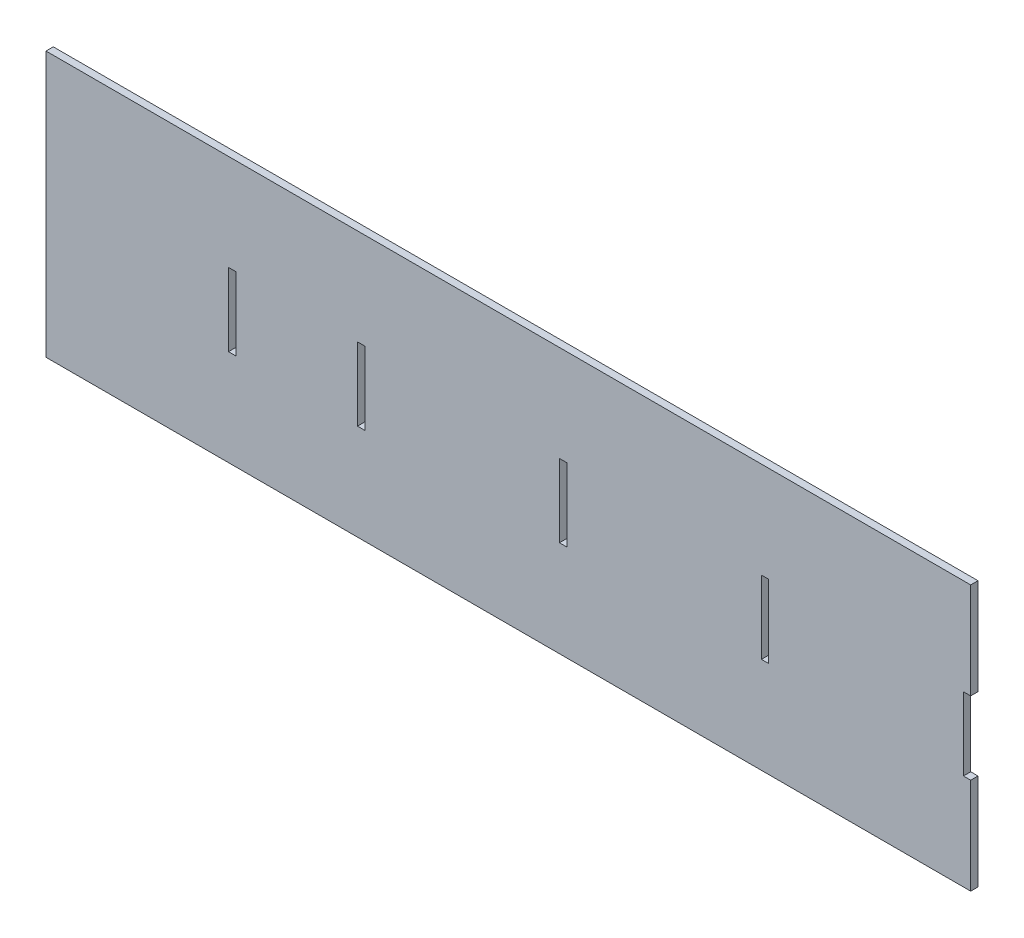
from build123d import *

# Parameters (mm, degrees)
SKETCH1_W           = 3
SKETCH1_H           = 30
BOSS_EXTRUDE1_DEPTH = 3


with BuildPart() as part:
    # Sketch1 → Boss-Extrude1 (new body)
    with BuildSketch(Plane.XY):
        Polygon((380, 109), (115, 109), (0, 109), (0, 0), (380, 0), (380, 39.5), (377, 39.5), (377, 69.5), (380, 69.5), align=None)
        with Locations((76.5, 54.5)):
            Rectangle(SKETCH1_W, SKETCH1_H, mode=Mode.SUBTRACT)
        with Locations((129.5, 54.5)):
            Rectangle(SKETCH1_W, SKETCH1_H, mode=Mode.SUBTRACT)
        with Locations((212.5, 54.5)):
            Rectangle(SKETCH1_W, SKETCH1_H, mode=Mode.SUBTRACT)
        with Locations((295.5, 54.5)):
            Rectangle(SKETCH1_W, SKETCH1_H, mode=Mode.SUBTRACT)
    extrude(amount=BOSS_EXTRUDE1_DEPTH)


solid = part.part
